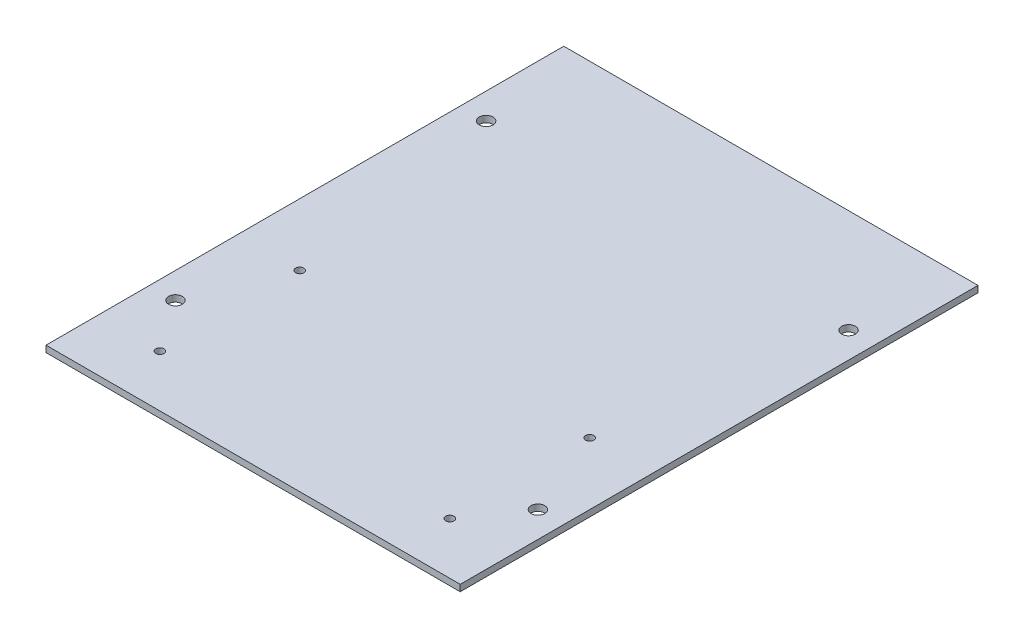
from build123d import *

# Parameters (mm, degrees)
SKETCH1_W              = 203.2
SKETCH1_H              = 254
BOSS_EXTRUDE1_DEPTH    = 3.175
SKETCH2_R              = 3.3734375
CUT_EXTRUDE1_DEPTH     = 326.294206258
F_10_32_TAPPED_HOLE1_D = 4.0386


with BuildPart() as part:
    # Sketch1 → Boss-Extrude1 (new body)
    with BuildSketch(Plane(origin=(0, 0, 0), x_dir=(1, 0, 0), z_dir=(0, 1, 0))):
        with Locations((101.6, 127)):
            Rectangle(SKETCH1_W, SKETCH1_H)
    extrude(amount=BOSS_EXTRUDE1_DEPTH)

    # Sketch2 → Cut-Extrude1 (cut, through all)
    with BuildSketch(Plane(origin=(0, 3.175, 0), x_dir=(1, 0, 0), z_dir=(0, 1, 0))):
        with Locations(Location((190.5, 203.2, 0), (0, 0, 270))):
            Circle(SKETCH2_R)
        with Locations(Location((12.7, 203.2, 0), (0, 0, 270))):
            Circle(SKETCH2_R)
        with Locations(Location((12.7, 50.8, 0), (0, 0, 270))):
            Circle(SKETCH2_R)
        with Locations(Location((190.5, 50.8, 0), (0, 0, 270))):
            Circle(SKETCH2_R)
    extrude(amount=-CUT_EXTRUDE1_DEPTH, mode=Mode.SUBTRACT)

    # #10-32 Tapped Hole1 (through all)
    with Locations(Plane(origin=(0, 3.175, 0), x_dir=(1, 0, 0), z_dir=(0, 1, 0))):
        with Locations((172.72, 25.4), (172.72, 93.98), (30.48, 25.4), (30.48, 93.98)):
            Hole(F_10_32_TAPPED_HOLE1_D / 2)


solid = part.part
